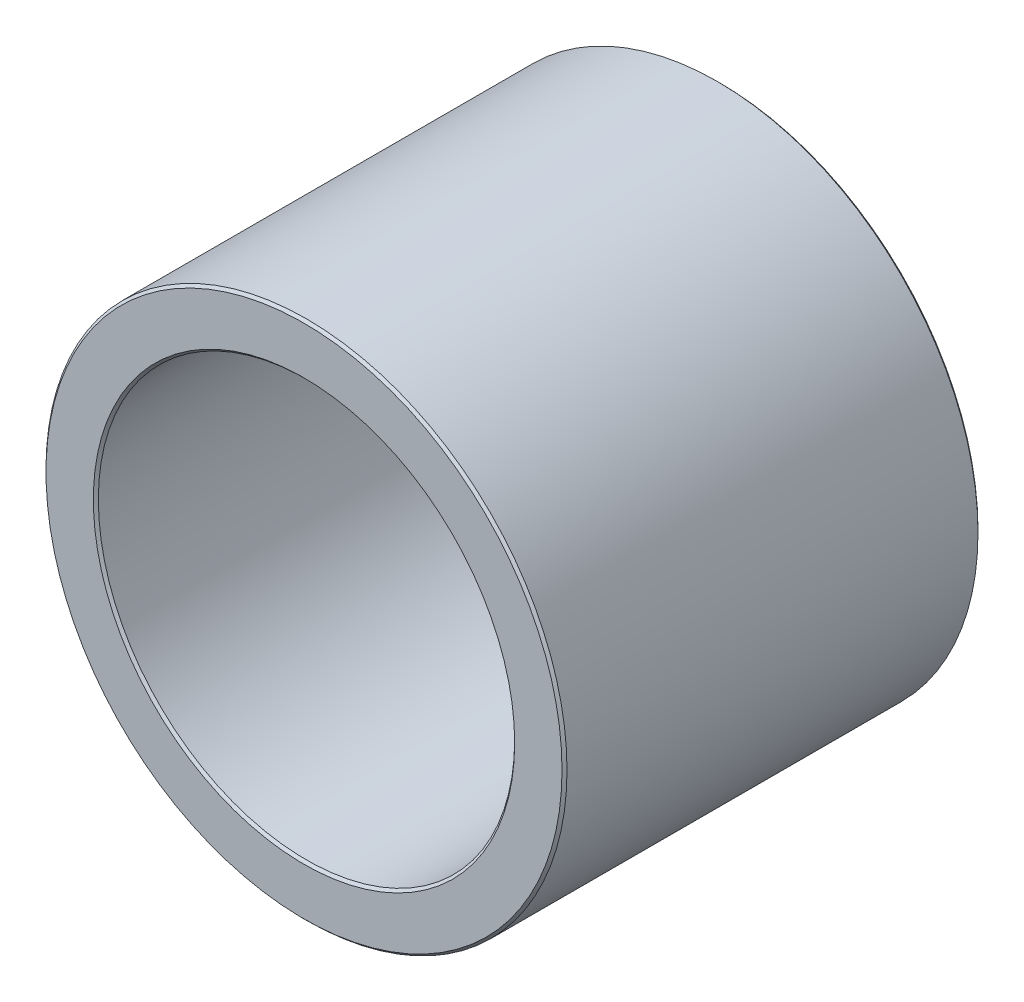
from build123d import *

# Parameters (mm, degrees)
BOSS_EXTRUDE1_DEPTH      = 6
BOSS_EXTRUDE1_DEPTH_BACK = 6
SKETCH5_R                = 7.515
SKETCH5_R_2              = 6.005
CHAMFER1_SIZE            = 0.07206


with BuildPart() as part:
    # Sketch5 → Boss-Extrude1 (new, two sides: drawn at the far end of the back side and taken through both)
    with BuildSketch(Plane.XY.offset(-BOSS_EXTRUDE1_DEPTH_BACK)):
        Circle(SKETCH5_R)
        Circle(SKETCH5_R_2, mode=Mode.SUBTRACT)
    extrude(amount=BOSS_EXTRUDE1_DEPTH + BOSS_EXTRUDE1_DEPTH_BACK)

    # Chamfer1
    chamfer1_edges = [part.edges().sort_by_distance(p)[0] for p in [
        (-7.515, 0, 6),
        (-6.005, 0, 6),
        (-7.515, 0, -6),
        (-6.005, 0, -6),
    ]]
    chamfer(chamfer1_edges, length=CHAMFER1_SIZE)


solid = part.part
